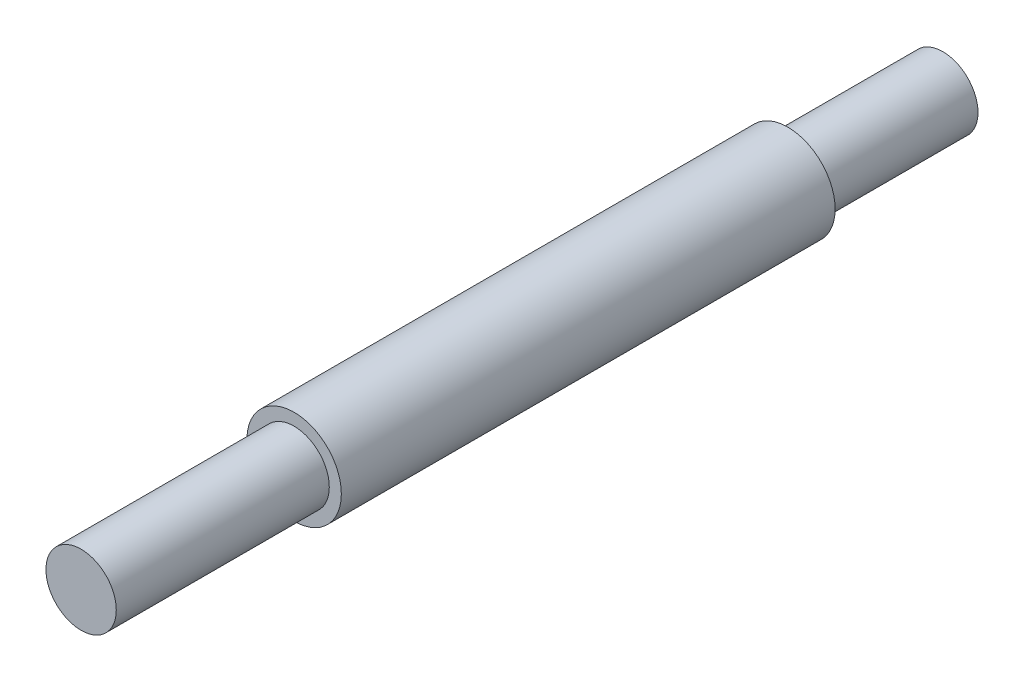
from build123d import *

# Parameters (mm, degrees)
SKETCH1_R               = 2.4384
SKETCH1_R_2             = 1.397
BOSS_EXTRUDE1_DEPTH     = 25.49906
CROQUIS1_R              = 1.8161
SALIENTE_EXTRUIR1_DEPTH = 11
CROQUIS2_R              = 1.8161
SALIENTE_EXTRUIR2_DEPTH = 8


with BuildPart() as part:
    # Sketch1 → Boss-Extrude1 (new body)
    with BuildSketch(Plane.XY):
        Circle(SKETCH1_R)
        Circle(SKETCH1_R_2, mode=Mode.SUBTRACT)
    extrude(amount=BOSS_EXTRUDE1_DEPTH)

    # Croquis1 → Saliente-Extruir1 (add)
    with BuildSketch(Plane.XY.offset(25.49906)):
        Circle(CROQUIS1_R)
    extrude(amount=SALIENTE_EXTRUIR1_DEPTH)

    # Croquis2 → Saliente-Extruir2 (add, symmetric)
    with BuildSketch(Plane(origin=(0, 0, 0), x_dir=(-1, 0, 0), z_dir=(0, 0, -1))):
        with Locations(Location((0, 0, 0), (0, 0, 180))):
            Circle(CROQUIS2_R)
    extrude(amount=SALIENTE_EXTRUIR2_DEPTH, both=True)


solid = part.part
